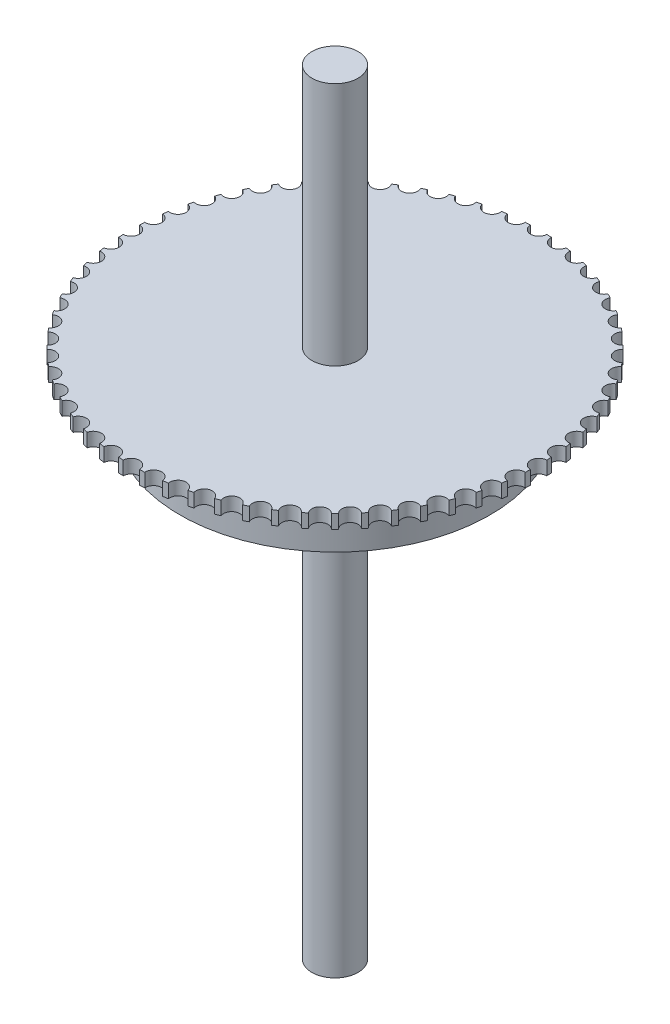
from build123d import *

# Parameters (mm, degrees)
F_6_0MM_DOWEL_HOLE1_D = 6
CIRPATTERN1_COUNT     = 60


with BuildPart() as part:
    # Sketch1 → Revolve1 (revolve)
    with BuildSketch(Plane.XY, mode=Mode.PRIVATE) as revolve1_sk:
        Polygon((0, 31.746365559), (-8.5, 31.746365559), (-8.5, -58.253634441), (-75, -58.253634441), (-75, -63.253634441), (-57, -63.253634441), (-57, -83.253634441), (-8.5, -83.253634441), (-8.5, -253.253634441), (0, -253.253634441), align=None)
    revolve(revolve1_sk.sketch.rotate(Axis((0, -253.253634441, 0), (0, 1, 0)), 270), axis=Axis((0, -253.253634441, 0), (0, 1, 0)))

    # Ø6.0mm Dowel Hole1 (through all)
    with Locations(Plane(origin=(0, -58.253634441, 0), x_dir=(1, 0, 0), z_dir=(0, 1, 0))):
        with Locations((0, 75)):
            f_6_0mm_dowel_hole1 = Hole(F_6_0MM_DOWEL_HOLE1_D / 2)

    # CirPattern1: Ø6.0mm Dowel Hole1 ×60 about axis
    cirpattern1_axis = Axis((0, 0, 0), (0, 1, 0))
    for i in range(1, CIRPATTERN1_COUNT):
        add(f_6_0mm_dowel_hole1.rotate(cirpattern1_axis, i * 360 / CIRPATTERN1_COUNT), mode=Mode.SUBTRACT)


solid = part.part
